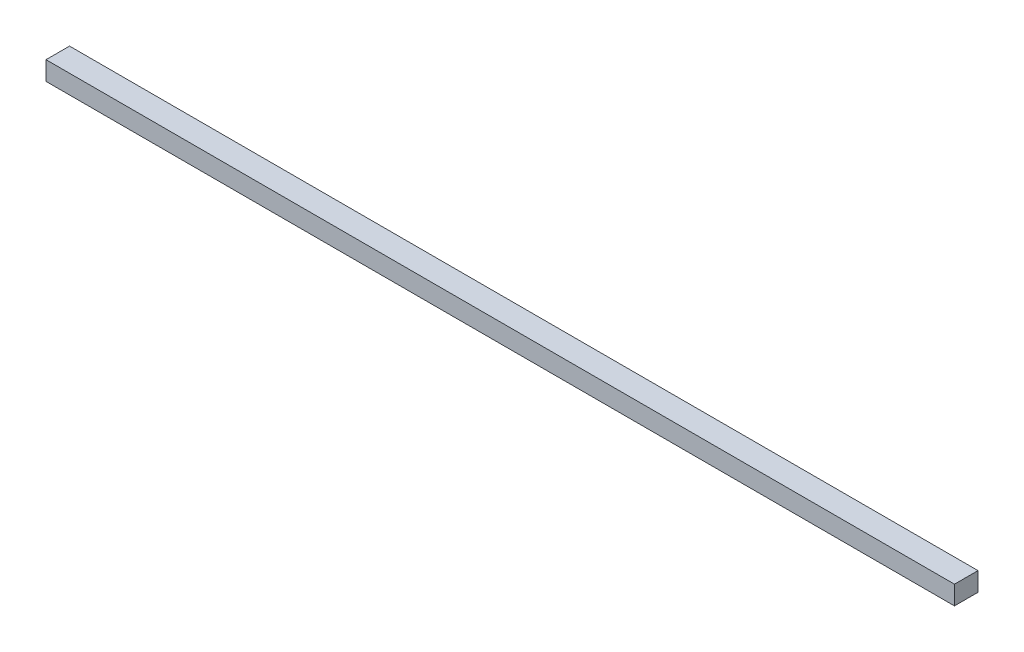
from build123d import *

# Parameters (mm, degrees)
SKETCH1_W           = 1930
SKETCH1_H           = 40
BOSS_EXTRUDE1_DEPTH = 50


with BuildPart() as part:
    # Sketch1 → Boss-Extrude1 (new body)
    with BuildSketch(Plane.XY):
        Rectangle(SKETCH1_W, SKETCH1_H)
    extrude(amount=BOSS_EXTRUDE1_DEPTH)


solid = part.part
